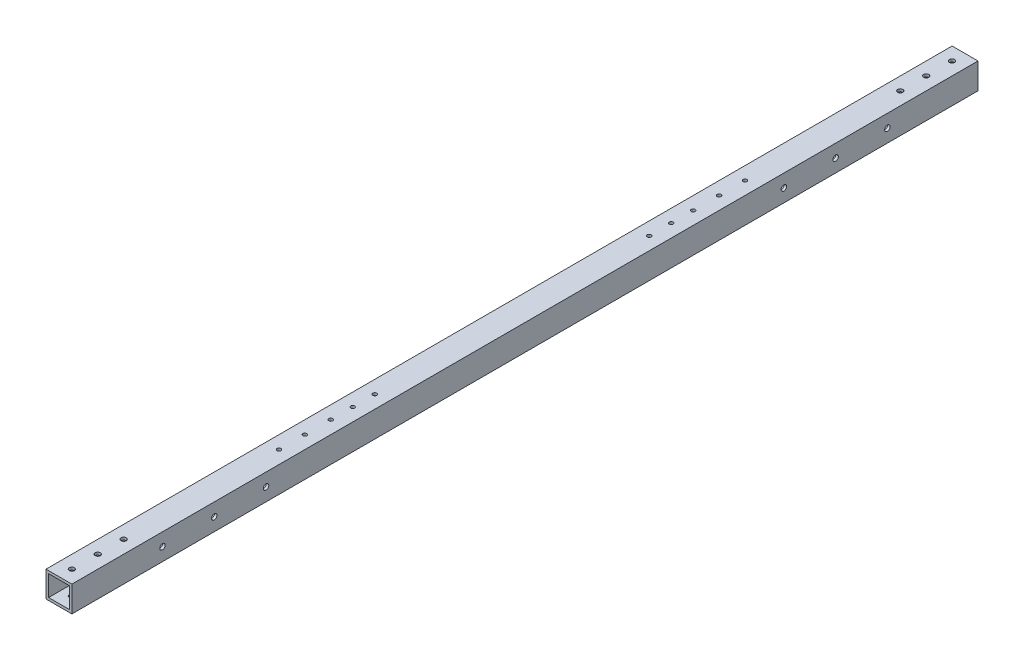
from build123d import *

# Parameters (mm, degrees)
SKETCH_1_W          = 20
SKETCH_1_H          = 20
SKETCH_1_W_2        = 16
SKETCH_1_H_2        = 16
EXTRUDE_1_DEPTH     = 700
SKETCH_3_R          = 2
CUT_EXTRUDE_2_DEPTH = 701.571195525
SKETCH_4_R          = 1.5
CUT_EXTRUDE_3_DEPTH = 701.571195525
SKETCH_5_R          = 2.1
CUT_EXTRUDE_4_DEPTH = 701.571195525


with BuildPart() as part:
    # 草图1 → 拉伸-薄壁1 (new body)
    with BuildSketch(Plane.XY):
        with Locations((10, 10)):
            Rectangle(SKETCH_1_W, SKETCH_1_H)
        with Locations((10, 10)):
            Rectangle(SKETCH_1_W_2, SKETCH_1_H_2, mode=Mode.SUBTRACT)
    extrude(amount=EXTRUDE_1_DEPTH)

    # 草图3 → 切除-拉伸2 (cut, through all)
    with BuildSketch(Plane.XZ):
        with Locations(Location((10, 10, 0), (0, 0, 270))):
            Circle(SKETCH_3_R)
        with Locations(Location((10, 30, 0), (0, 0, 270))):
            Circle(SKETCH_3_R)
        with Locations(Location((10, 50, 0), (0, 0, 270))):
            Circle(SKETCH_3_R)
        with Locations(Location((10, 690, 0), (0, 0, 270))):
            Circle(SKETCH_3_R)
        with Locations(Location((10, 670, 0), (0, 0, 270))):
            Circle(SKETCH_3_R)
        with Locations(Location((10, 650, 0), (0, 0, 270))):
            Circle(SKETCH_3_R)
    extrude(amount=-CUT_EXTRUDE_2_DEPTH, mode=Mode.SUBTRACT)

    # 草图4 → 切除-拉伸3 (cut, through all)
    with BuildSketch(Plane.XZ):
        with Locations(Location((10, 170, 0), (0, 0, 270))):
            Circle(SKETCH_4_R)
        with Locations(Location((10, 190, 0), (0, 0, 270))):
            Circle(SKETCH_4_R)
        with Locations(Location((10, 210, 0), (0, 0, 270))):
            Circle(SKETCH_4_R)
        with Locations(Location((10, 490, 0), (0, 0, 270))):
            Circle(SKETCH_4_R)
        with Locations(Location((10, 510, 0), (0, 0, 270))):
            Circle(SKETCH_4_R)
        with Locations(Location((10, 530, 0), (0, 0, 270))):
            Circle(SKETCH_4_R)
        with Locations(Location((10, 473, 0), (0, 0, 270))):
            Circle(SKETCH_4_R)
        with Locations(Location((10, 456, 0), (0, 0, 270))):
            Circle(SKETCH_4_R)
        with Locations(Location((10, 227, 0), (0, 0, 270))):
            Circle(SKETCH_4_R)
        with Locations(Location((10, 244, 0), (0, 0, 270))):
            Circle(SKETCH_4_R)
    extrude(amount=-CUT_EXTRUDE_3_DEPTH, mode=Mode.SUBTRACT)

    # 草图5 → 切除-拉伸4 (cut, through all)
    with BuildSketch(Plane(origin=(20, 0, 0), x_dir=(0, 0, -1), z_dir=(1, 0, 0))):
        with Locations((-70, 10)):
            Circle(SKETCH_5_R)
        with Locations((-110, 10)):
            Circle(SKETCH_5_R)
        with Locations((-150, 10)):
            Circle(SKETCH_5_R)
        with Locations(Location((-550, 10, 0), (0, 0, 180))):
            Circle(SKETCH_5_R)
        with Locations(Location((-590, 10, 0), (0, 0, 180))):
            Circle(SKETCH_5_R)
        with Locations(Location((-630, 10, 0), (0, 0, 180))):
            Circle(SKETCH_5_R)
    extrude(amount=-CUT_EXTRUDE_4_DEPTH, mode=Mode.SUBTRACT)


solid = part.part
